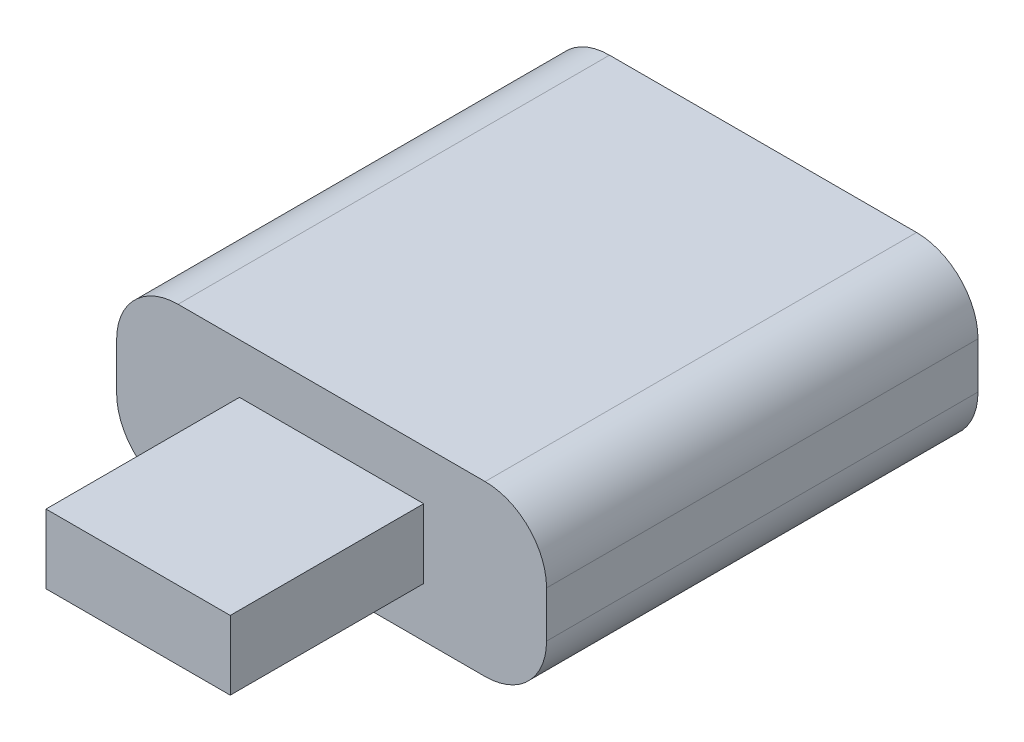
from build123d import *

# Parameters (mm, degrees)
BOSS_EXTRUDE1_DEPTH      = 5.5
BOSS_EXTRUDE1_DEPTH_BACK = 5.5
BOSS_EXTRUDE2_DEPTH      = 2.25
BOSS_EXTRUDE2_DEPTH_BACK = 2.25
SKETCH1_4_W              = 12
SKETCH1_4_H              = 12.6
FILLET2_R                = 4


with BuildPart() as part:
    # Sketch1 → Boss-Extrude1 (new, two sides: drawn at the far end of the back side and taken through both)
    with BuildSketch(Plane(origin=(0, 0, 0), x_dir=(1, 0, 0), z_dir=(0, 1, 0)).offset(-BOSS_EXTRUDE1_DEPTH_BACK)):
        Polygon((14, 14.05), (-14, 14.05), (-14, -14.05), (-6, -14.05), (6, -14.05), (14, -14.05), align=None)
    extrude(amount=BOSS_EXTRUDE1_DEPTH + BOSS_EXTRUDE1_DEPTH_BACK)

    # Sketch1<4> → Boss-Extrude2 (add, two sides: drawn at the far end of the back side and taken through both)
    with BuildSketch(Plane(origin=(0, 0, 0), x_dir=(1, 0, 0), z_dir=(0, 1, 0)).offset(-BOSS_EXTRUDE2_DEPTH_BACK)):
        with Locations((0, -20.35)):
            Rectangle(SKETCH1_4_W, SKETCH1_4_H)
    extrude(amount=BOSS_EXTRUDE2_DEPTH + BOSS_EXTRUDE2_DEPTH_BACK)

    # Fillet2
    fillet2_edges = [part.edges().sort_by_distance(p)[0] for p in [
        (-14, -5.5, 0),
        (-14, 5.5, 0),
        (14, -5.5, 0),
        (14, 5.5, 0),
    ]]
    fillet(fillet2_edges, radius=FILLET2_R)


solid = part.part
